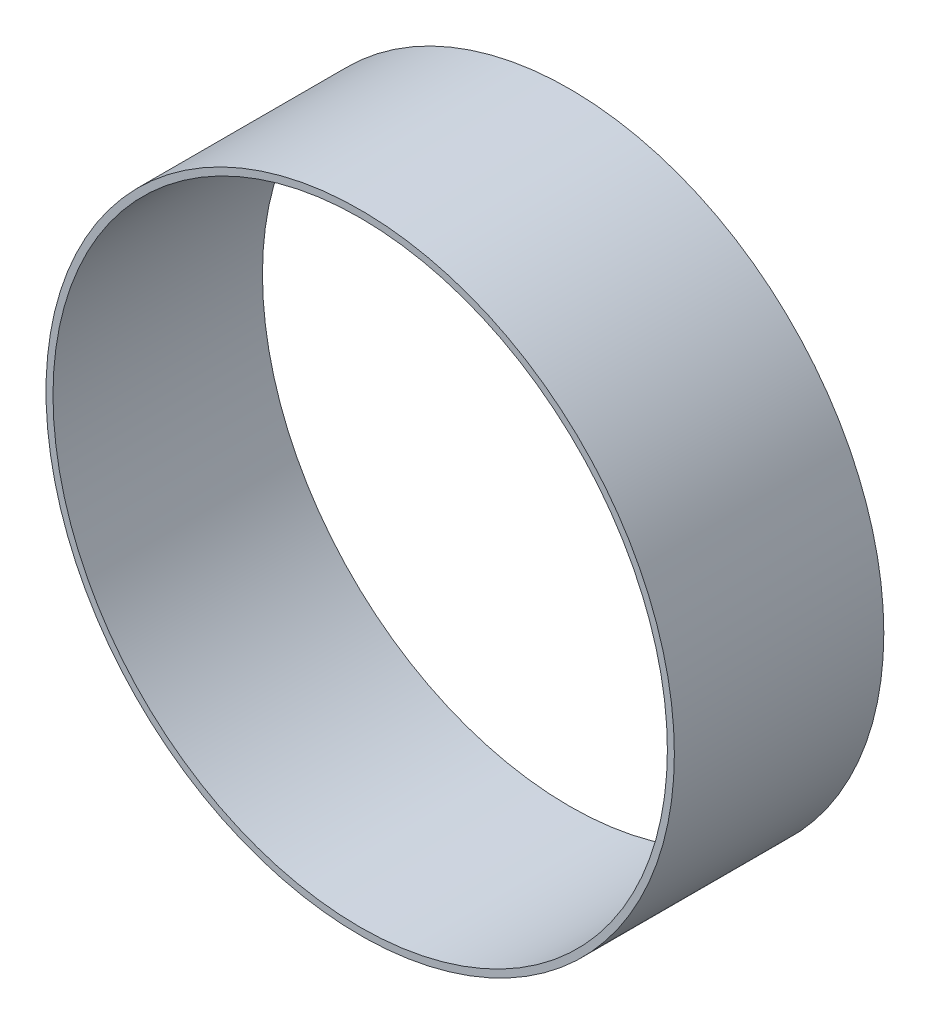
from build123d import *

# Parameters (mm, degrees)
SKETCH1_R           = 142.875
SKETCH1_R_2         = 139.7
BOSS_EXTRUDE1_DEPTH = 95.25


with BuildPart() as part:
    # Sketch1 → Boss-Extrude1 (new body)
    with BuildSketch(Plane.XY):
        Circle(SKETCH1_R)
        Circle(SKETCH1_R_2, mode=Mode.SUBTRACT)
    extrude(amount=BOSS_EXTRUDE1_DEPTH)


solid = part.part
